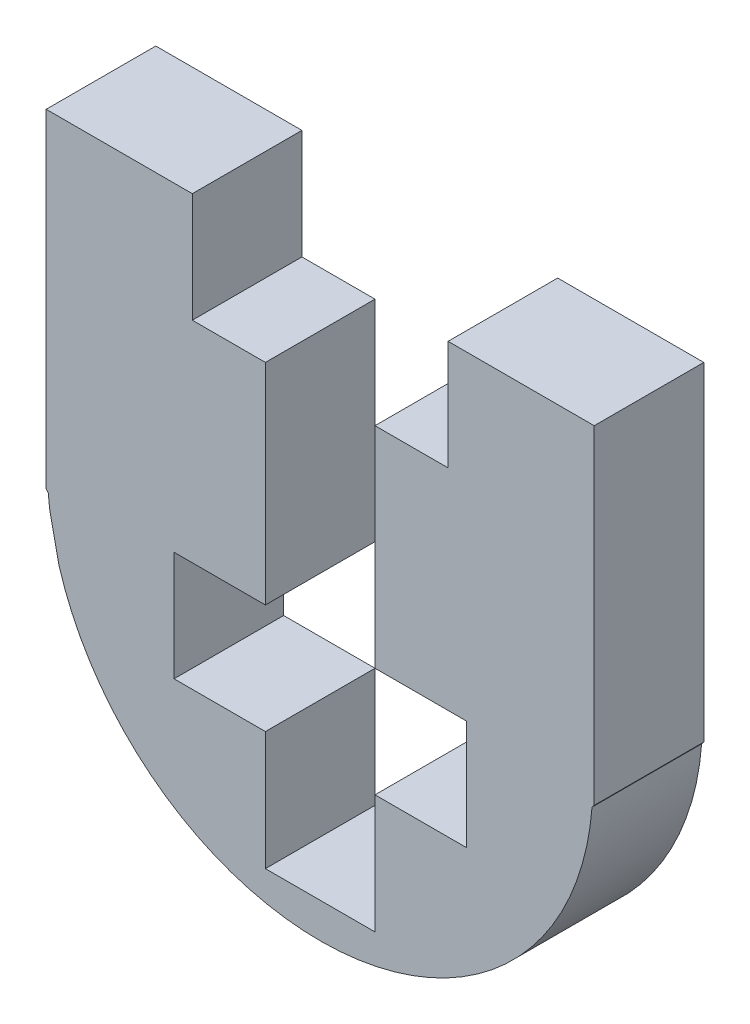
from build123d import *

# Parameters (mm, degrees)
SALIENTE_EXTRUIR1_DEPTH = 3
CORTAR_EXTRUIR1_DEPTH   = 10
CROQUIS3_W              = 2
CROQUIS3_H              = 3
CORTAR_EXTRUIR2_DEPTH   = 10
SALIENTE_EXTRUIR2_START = -3
SALIENTE_EXTRUIR2_DEPTH = 3


with BuildPart() as part:
    # Croquis1 → Saliente-Extruir1 (new body)
    with BuildSketch(Plane.XY):
        with BuildLine():
            Line((-7.5, -0.5), (-7.5, 8.5))
            Line((-7.5, 8.5), (7.5, 8.5))
            Line((7.5, 8.5), (7.5, -0.5))
            Line((7.5, -0.5), (5, -3.5))
            Line((5, -3.5), (3, -4.462410552))
            ThreePointArc((3, -4.462410552), (0, -7.462410552), (-3, -4.462410552))
            Line((-3, -4.462410552), (-5, -3.5))
            Line((-5, -3.5), (-7.5, -0.5))
        make_face()
    extrude(amount=SALIENTE_EXTRUIR1_DEPTH)

    # Croquis2 → Cortar-Extruir1 (cut)
    with BuildSketch(Plane.XY.offset(3)):
        Polygon((1.5, 8.5), (-1.5, 8.5), (-1.5, -0.25), (-4, -0.25), (-4, -3.25), (-1.5, -3.25), (-1.5, -6.5), (1.5, -6.5), (1.5, -3.25), (4, -3.25), (4, -0.25), (1.5, -0.25), align=None)
    extrude(amount=-CORTAR_EXTRUIR1_DEPTH, mode=Mode.SUBTRACT)

    # Croquis3 → Cortar-Extruir2 (cut)
    with BuildSketch(Plane.XY.offset(3)):
        with Locations((-2.5, 7)):
            Rectangle(CROQUIS3_W, CROQUIS3_H)
        with Locations((2.5, 7)):
            Rectangle(CROQUIS3_W, CROQUIS3_H)
    extrude(amount=-CORTAR_EXTRUIR2_DEPTH, mode=Mode.SUBTRACT)

    # Croquis5 → Saliente-Extruir2 (add)
    with BuildSketch(Plane.XY.offset(3).offset(SALIENTE_EXTRUIR2_START)):
        with BuildLine():
            ThreePointArc((-7.440502446, -0.571397065), (-7.422411846, -0.771604582), (-7.39893509, -0.971252175))
            Line((-7.39893509, -0.971252175), (-7.146532031, -2.148173916))
            ThreePointArc((-7.146532031, -2.148173916), (-4.452921263, -5.988243772), (0, -7.462410552))
            ThreePointArc((0, -7.462410552), (-2.121320344, -6.583730896), (-3, -4.462410552))
            Line((-3, -4.462410552), (-5, -3.5))
            Line((-5, -3.5), (-7.440502446, -0.571397065))
        make_face()
        with BuildLine():
            ThreePointArc((3, -4.462410552), (2.121320344, -6.583730896), (0, -7.462410552))
            ThreePointArc((0, -7.462410552), (5.070679035, -5.475014646), (7.440502446, -0.571397065))
            Line((7.440502446, -0.571397065), (5, -3.5))
            Line((5, -3.5), (3, -4.462410552))
        make_face()
    extrude(amount=SALIENTE_EXTRUIR2_DEPTH)


solid = part.part
